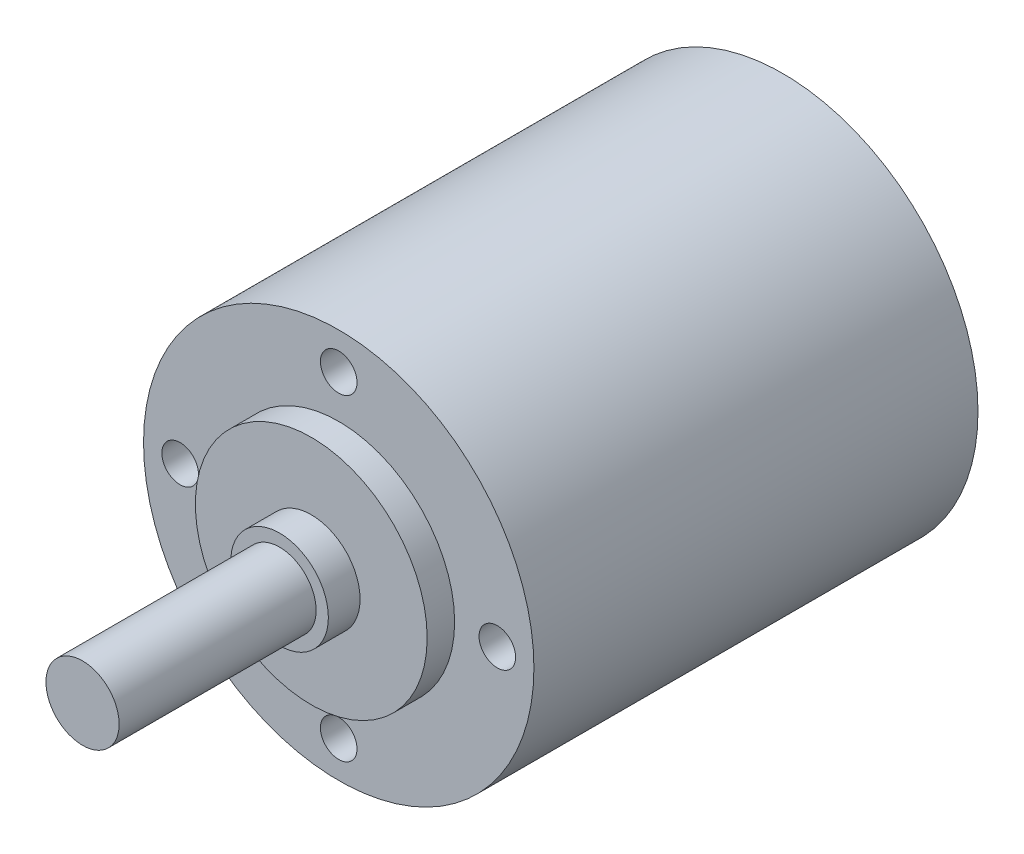
from build123d import *

# Parameters (mm, degrees)
ESQUISSE1_R             = 16
BOSS_EXTRU_1_DEPTH      = 36.4
ESQUISSE2_R             = 9.5
BOSS_EXTRU_2_DEPTH      = 2.25
ESQUISSE3_R             = 4
BOSS_EXTRU_3_DEPTH      = 2.6
ESQUISSE4_R             = 3
BOSS_EXTRU_4_DEPTH      = 16.15
ESQUISSE5_R             = 1.5
ENL_V_MAT_EXTRU_1_DEPTH = 3.8


with BuildPart() as part:
    # Esquisse1 → Boss.-Extru.1 (new body)
    with BuildSketch(Plane.XY):
        Circle(ESQUISSE1_R)
    extrude(amount=BOSS_EXTRU_1_DEPTH)

    # Esquisse2 → Boss.-Extru.2 (add)
    with BuildSketch(Plane.XY.offset(36.4)):
        Circle(ESQUISSE2_R)
    extrude(amount=BOSS_EXTRU_2_DEPTH)

    # Esquisse3 → Boss.-Extru.3 (add)
    with BuildSketch(Plane.XY.offset(38.65)):
        Circle(ESQUISSE3_R)
    extrude(amount=BOSS_EXTRU_3_DEPTH)

    # Esquisse4 → Boss.-Extru.4 (add)
    with BuildSketch(Plane.XY.offset(41.25)):
        Circle(ESQUISSE4_R)
    extrude(amount=BOSS_EXTRU_4_DEPTH)

    # Esquisse5 → Enlèv. mat.-Extru.1 (cut)
    with BuildSketch(Plane.XY.offset(36.4)):
        with Locations((0, 13)):
            Circle(ESQUISSE5_R)
        with Locations((13, 0)):
            Circle(ESQUISSE5_R)
        with Locations((0, -13)):
            Circle(ESQUISSE5_R)
        with Locations((-13, 0)):
            Circle(ESQUISSE5_R)
    extrude(amount=-ENL_V_MAT_EXTRU_1_DEPTH, mode=Mode.SUBTRACT)


solid = part.part
